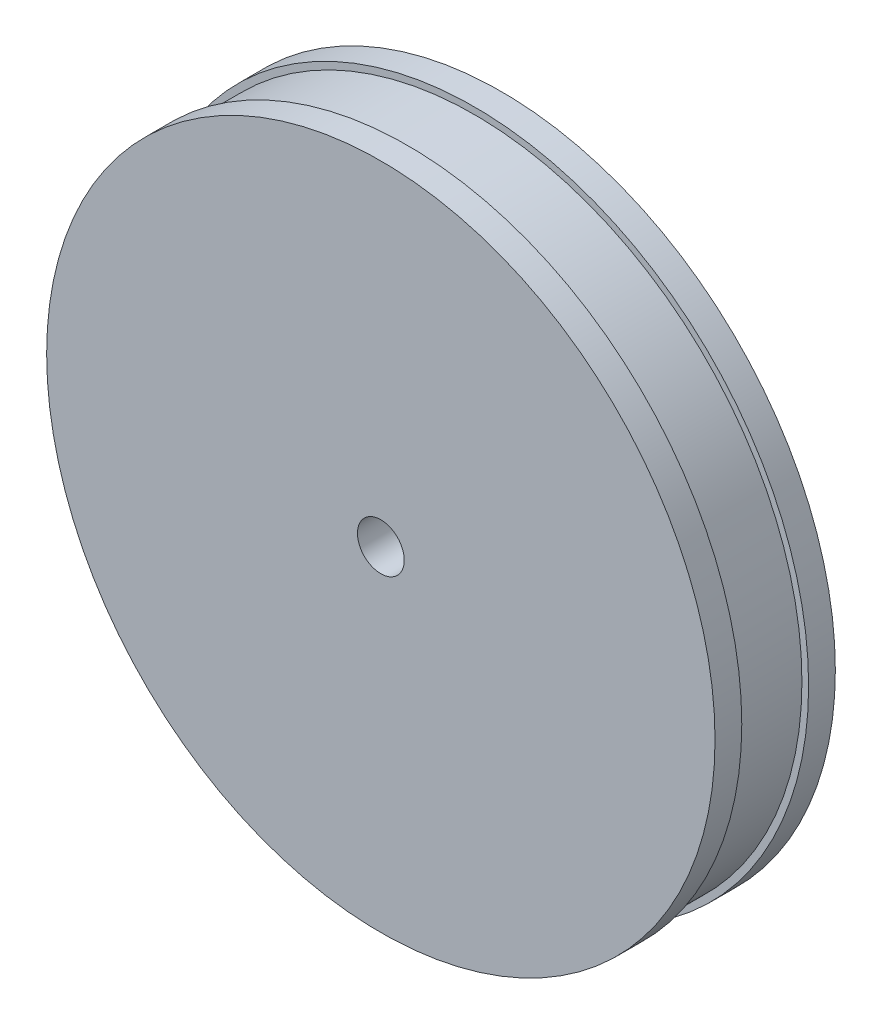
from build123d import *

# Parameters (mm, degrees)
ESQUISSE1_R             = 24.5
BOSS_EXTRU_1_DEPTH      = 5
ESQUISSE2_R             = 25
BOSS_EXTRU_2_DEPTH      = 2
BOSS_EXTRU_4_START      = 2
ESQUISSE5_R             = 25
BOSS_EXTRU_4_DEPTH      = 2
ESQUISSE4_R             = 1.75
ENL_V_MAT_EXTRU_1_DEPTH = 37.482872694


with BuildPart() as part:
    # Esquisse1 → Boss.-Extru.1 (new body)
    with BuildSketch(Plane.XY):
        Circle(ESQUISSE1_R)
    extrude(amount=BOSS_EXTRU_1_DEPTH)

    # Esquisse2 → Boss.-Extru.2 (add)
    with BuildSketch(Plane(origin=(0, 0, 0), x_dir=(-1, 0, 0), z_dir=(0, 0, -1))):
        Circle(ESQUISSE2_R)
    extrude(amount=BOSS_EXTRU_2_DEPTH)

    # Esquisse5 → Boss.-Extru.4 (add)
    with BuildSketch(Plane.XY.offset(5).offset(BOSS_EXTRU_4_START)):
        with Locations(Location((0, 0, 0), (0, 0, 180))):
            Circle(ESQUISSE5_R)
    extrude(amount=-BOSS_EXTRU_4_DEPTH)

    # Esquisse4 → Enlèv. mat.-Extru.1 (cut, through all)
    with BuildSketch(Plane(origin=(0, 0, -2), x_dir=(-1, 0, 0), z_dir=(0, 0, -1))):
        Circle(ESQUISSE4_R)
    extrude(amount=-ENL_V_MAT_EXTRU_1_DEPTH, mode=Mode.SUBTRACT)


solid = part.part
